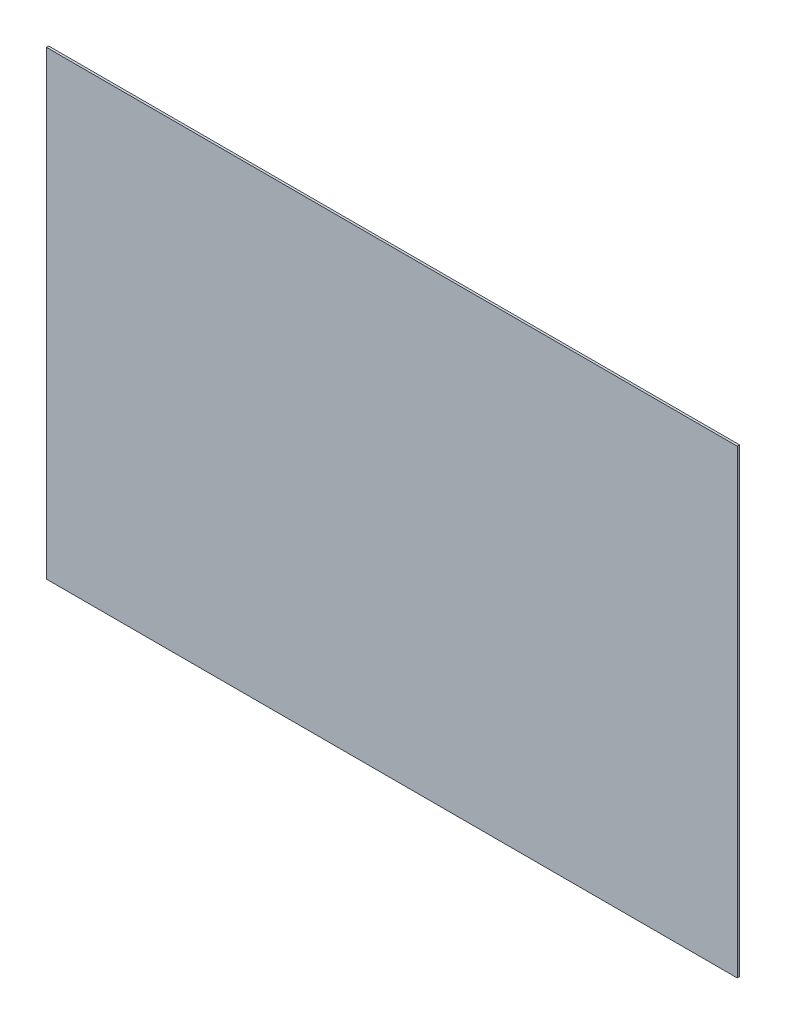
from build123d import *

# Parameters (mm, degrees)
ESQUISSE1_W        = 600
ESQUISSE1_H        = 400
BOSS_EXTRU_1_DEPTH = 2


with BuildPart() as part:
    # Esquisse1 → Boss.-Extru.1 (new body)
    with BuildSketch(Plane.XY):
        with Locations((-300, 200)):
            Rectangle(ESQUISSE1_W, ESQUISSE1_H)
    extrude(amount=BOSS_EXTRU_1_DEPTH)


solid = part.part
